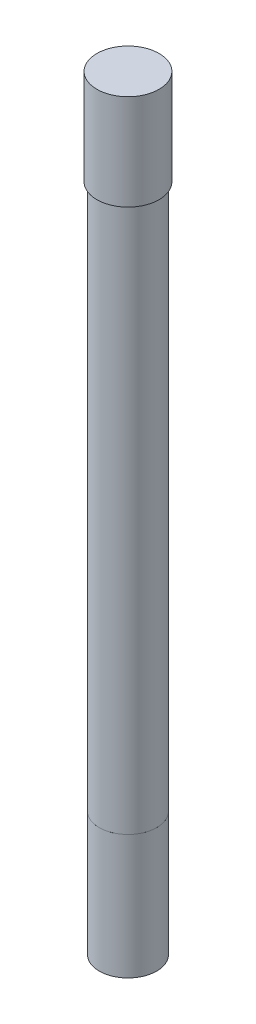
from build123d import *

# Parameters (mm, degrees)
SK_BULB_GUARD_R      = 6
BULB_GUARD_DEPTH     = 26
ELECTRODE_START      = 26
SK_ELECTRODE_BODY_R  = 6
ELECTRODE_BODY_DEPTH = 114
ELECTRODE_START_2    = 140
SK_ELECTRODE_CAP_R   = 6.5
ELECTRODE_CAP_DEPTH  = 20


with BuildPart() as part:
    # SK Bulb guard → Bulb guard (new body)
    with BuildSketch(Plane(origin=(0, 0, 0), x_dir=(1, 0, 0), z_dir=(0, 1, 0))):
        Circle(SK_BULB_GUARD_R)
    extrude(amount=BULB_GUARD_DEPTH)


with BuildPart() as body_2:
    # SK Electrode body → Electrode body (new body)
    with BuildSketch(Plane(origin=(0, 0, 0), x_dir=(1, 0, 0), z_dir=(0, 1, 0)).offset(ELECTRODE_START)):
        Circle(SK_ELECTRODE_BODY_R)
    extrude(amount=ELECTRODE_BODY_DEPTH)


with BuildPart() as body_3:
    # SK Electrode cap → Electrode cap (new body)
    with BuildSketch(Plane(origin=(0, 0, 0), x_dir=(1, 0, 0), z_dir=(0, 1, 0)).offset(ELECTRODE_START_2)):
        Circle(SK_ELECTRODE_CAP_R)
    extrude(amount=ELECTRODE_CAP_DEPTH)


solid = Compound([part.part, body_2.part, body_3.part])
